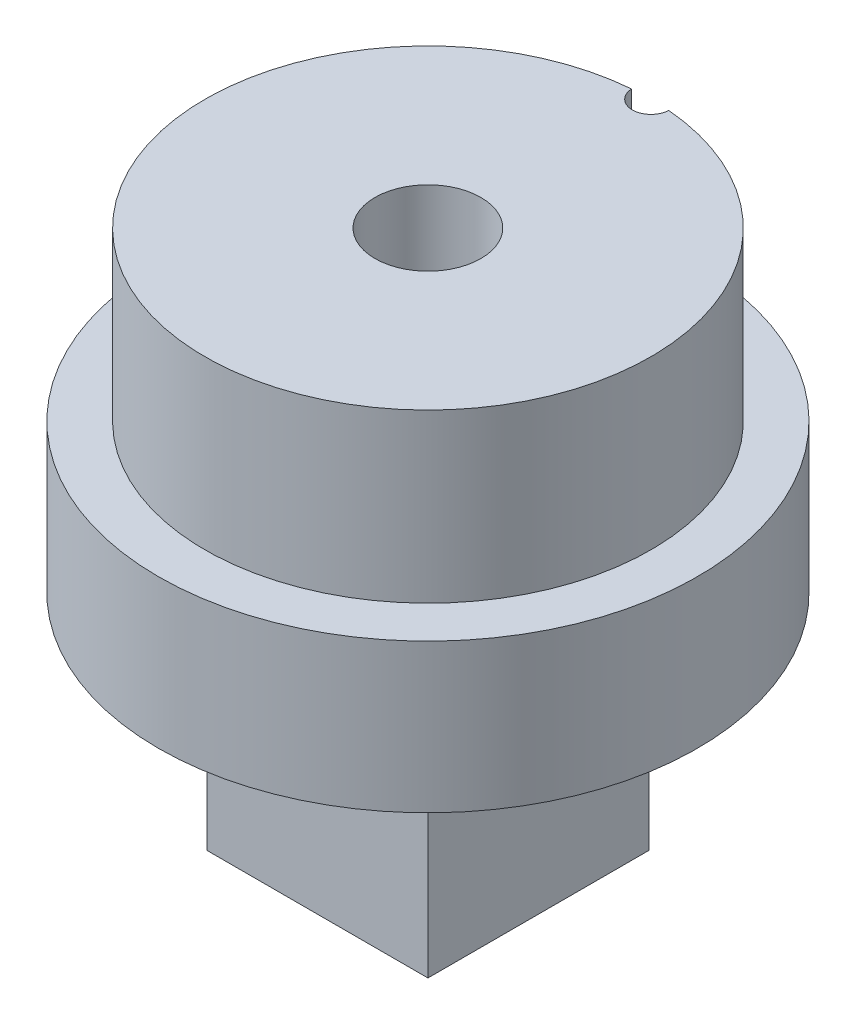
from build123d import *

# Parameters (mm, degrees)
SKETCH1_W           = 5.95
SKETCH1_H           = 5.95
BOSS_EXTRUDE1_DEPTH = 6
SKETCH2_R           = 7.25
BOSS_EXTRUDE2_DEPTH = 4
SKETCH3_R           = 1.425
CUT_EXTRUDE1_DEPTH  = 15.322185587
SKETCH4_R           = 1.425
BOSS_EXTRUDE4_DEPTH = 4.5


with BuildPart() as part:
    # Sketch1 → Boss-Extrude1 (new body)
    with BuildSketch(Plane(origin=(0, 0, 0), x_dir=(1, 0, 0), z_dir=(0, 1, 0))):
        Rectangle(SKETCH1_W, SKETCH1_H)
    extrude(amount=BOSS_EXTRUDE1_DEPTH)

    # Sketch2 → Boss-Extrude2 (add)
    with BuildSketch(Plane(origin=(0, 6, 0), x_dir=(1, 0, 0), z_dir=(0, 1, 0))):
        with Locations(Location((0, 0, 0), (0, 0, 270))):
            Circle(SKETCH2_R)
    extrude(amount=BOSS_EXTRUDE2_DEPTH)

    # Sketch3 → Cut-Extrude1 (cut, through all)
    with BuildSketch(Plane.XZ):
        with Locations(Location((0, 0, 0), (0, 0, 270))):
            Circle(SKETCH3_R)
    extrude(amount=-CUT_EXTRUDE1_DEPTH, mode=Mode.SUBTRACT)

    # Sketch4 → Boss-Extrude4 (add)
    with BuildSketch(Plane(origin=(0, 10, 0), x_dir=(1, 0, 0), z_dir=(0, 1, 0))):
        with BuildLine():
            ThreePointArc((-0.499565784, 5.979166667), (-4.062179544, -4.415732935), (6, 0))
            ThreePointArc((6, 0), (4.415732935, 4.062179544), (0.499565784, 5.979166667))
            ThreePointArc((0.499565784, 5.979166667), (0, 5.5), (-0.499565784, 5.979166667))
        make_face()
        with Locations(Location((0, 0, 0), (0, 0, 90))):
            Circle(SKETCH4_R, mode=Mode.SUBTRACT)
    extrude(amount=BOSS_EXTRUDE4_DEPTH)


solid = part.part
